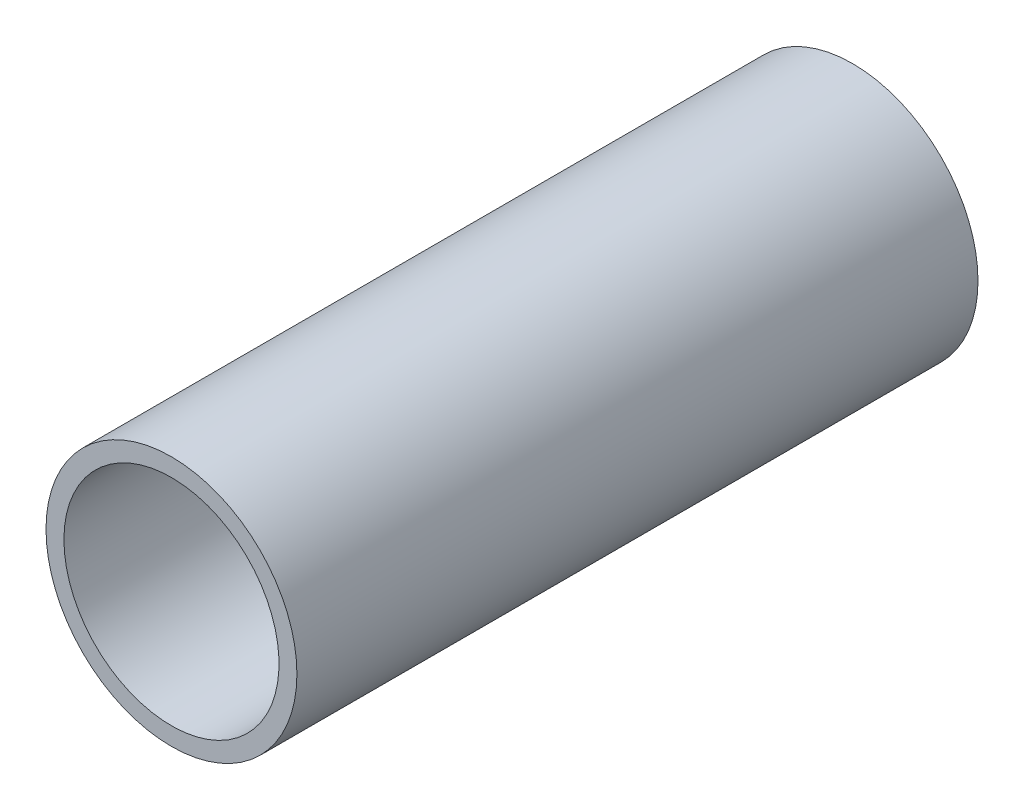
from build123d import *

# Parameters (mm, degrees)
SKETCH1_R           = 5.55625
SKETCH1_R_2         = 4.7625
BOSS_EXTRUDE1_DEPTH = 30.1625


with BuildPart() as part:
    # Sketch1 → Boss-Extrude1 (new body)
    with BuildSketch(Plane.XY):
        with Locations(Location((0, 0, 0), (0, 0, 180))):
            Circle(SKETCH1_R)
        with Locations(Location((0, 0, 0), (0, 0, 180))):
            Circle(SKETCH1_R_2, mode=Mode.SUBTRACT)
    extrude(amount=BOSS_EXTRUDE1_DEPTH)


solid = part.part
